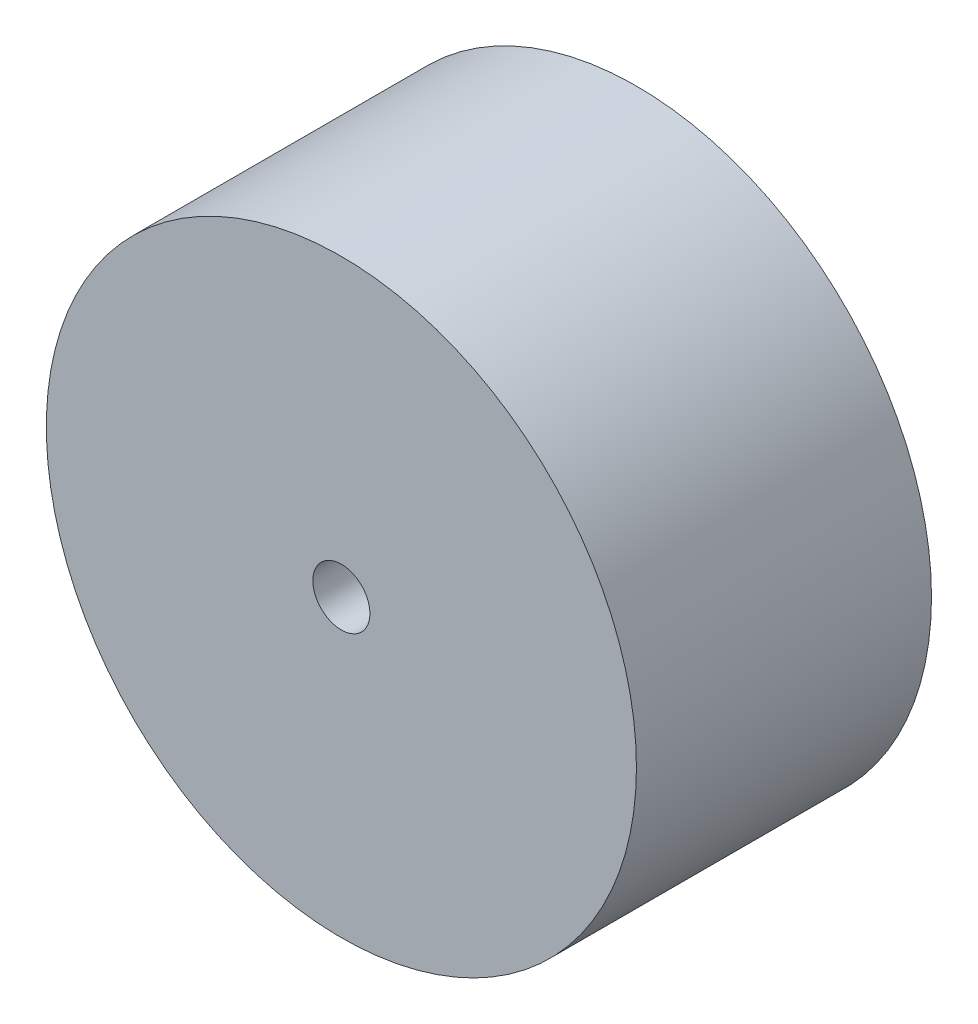
from build123d import *

# Parameters (mm, degrees)
SZKIC1_R                    = 15
SZKIC1_R_2                  = 1.45
DODANIE_WYCI_GNI_CIE1_DEPTH = 15


with BuildPart() as part:
    # Szkic1 → Dodanie-wyciągnięcie1 (new body)
    with BuildSketch(Plane.XY):
        Circle(SZKIC1_R)
        Circle(SZKIC1_R_2, mode=Mode.SUBTRACT)
    extrude(amount=DODANIE_WYCI_GNI_CIE1_DEPTH)


solid = part.part
